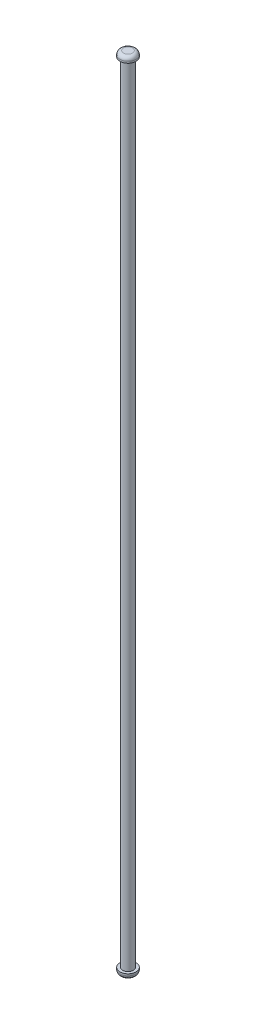
from build123d import *

# Parameters (mm, degrees)
SKETCH1_R           = 1.5
BOSS_EXTRUDE1_DEPTH = 224
SKETCH2_R           = 2.25
BOSS_EXTRUDE2_DEPTH = 1.5
FILLET1_R           = 1
BOSS_EXTRUDE3_START = -1.5
SKETCH3_R           = 2.25
BOSS_EXTRUDE3_DEPTH = 1.5
FILLET2_R           = 1


with BuildPart() as part:
    # Sketch1 → Boss-Extrude1 (new body)
    with BuildSketch(Plane(origin=(0, 0, 0), x_dir=(1, 0, 0), z_dir=(0, 1, 0))):
        with Locations(Location((0, 0, 0), (0, 0, 270))):
            Circle(SKETCH1_R)
    extrude(amount=BOSS_EXTRUDE1_DEPTH)

    # Sketch2 → Boss-Extrude2 (add)
    with BuildSketch(Plane(origin=(0, 224, 0), x_dir=(1, 0, 0), z_dir=(0, 1, 0))):
        with Locations(Location((0, 0, 0), (0, 0, 270))):
            Circle(SKETCH2_R)
    extrude(amount=-BOSS_EXTRUDE2_DEPTH)

    # Fillet1
    fillet1_edges = [part.edges().sort_by_distance(p)[0] for p in [
        (0, 224, -2.25),
    ]]
    fillet(fillet1_edges, radius=FILLET1_R)

    # Sketch3 → Boss-Extrude3 (add)
    with BuildSketch(Plane.XZ.offset(BOSS_EXTRUDE3_START)):
        with Locations(Location((0, 0, 0), (0, 0, 90))):
            Circle(SKETCH3_R)
    extrude(amount=BOSS_EXTRUDE3_DEPTH)

    # Fillet2
    fillet2_edges = [part.edges().sort_by_distance(p)[0] for p in [
        (0, 0, -2.25),
    ]]
    fillet(fillet2_edges, radius=FILLET2_R)


solid = part.part
